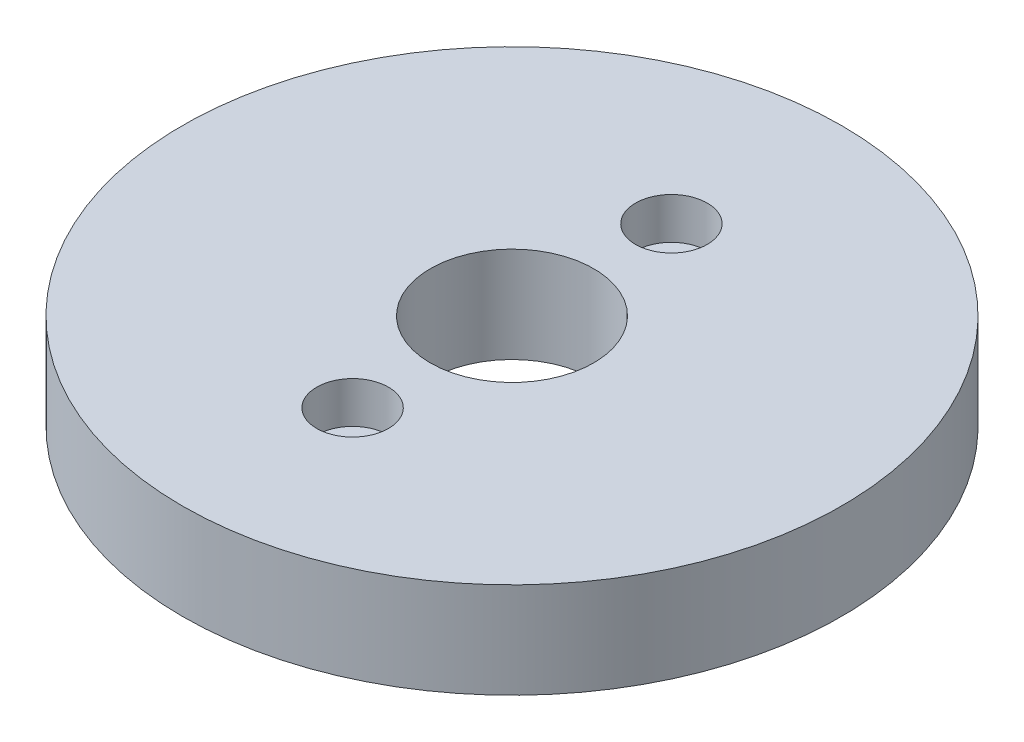
from build123d import *

# Parameters (mm, degrees)
SKETCH1_R           = 41.35
BOSS_EXTRUDE1_DEPTH = 12
SKETCH2_R           = 2.75
CUT_EXTRUDE1_DEPTH  = 25
SKETCH4_R           = 10.25
CUT_EXTRUDE2_DEPTH  = 25
SKETCH3_R           = 4.5
CUT_EXTRUDE3_DEPTH  = 5.2


with BuildPart() as part:
    # Sketch1 → Boss-Extrude1 (new body)
    with BuildSketch(Plane(origin=(0, 0, 0), x_dir=(1, 0, 0), z_dir=(0, 1, 0))):
        with Locations(Location((0, 0, 0), (0, 0, 270))):
            Circle(SKETCH1_R)
    extrude(amount=BOSS_EXTRUDE1_DEPTH)

    # Sketch2 → Cut-Extrude1 (cut)
    with BuildSketch(Plane(origin=(0, 12, 0), x_dir=(1, 0, 0), z_dir=(0, 1, 0))):
        with Locations(Location((0, 20, 0), (0, 0, 270))):
            Circle(SKETCH2_R)
        with Locations(Location((0, -20, 0), (0, 0, 270))):
            Circle(SKETCH2_R)
    extrude(amount=-CUT_EXTRUDE1_DEPTH, mode=Mode.SUBTRACT)

    # Sketch4 → Cut-Extrude2 (cut)
    with BuildSketch(Plane(origin=(0, 12, 0), x_dir=(1, 0, 0), z_dir=(0, 1, 0))):
        with Locations(Location((0, 0, 0), (0, 0, 270))):
            Circle(SKETCH4_R)
    extrude(amount=-CUT_EXTRUDE2_DEPTH, mode=Mode.SUBTRACT)

    # Sketch3 → Cut-Extrude3 (cut)
    with BuildSketch(Plane(origin=(0, 12, 0), x_dir=(1, 0, 0), z_dir=(0, 1, 0))):
        with Locations(Location((0, 20, 0), (0, 0, 270))):
            Circle(SKETCH3_R)
        with Locations(Location((0, -20, 0), (0, 0, 270))):
            Circle(SKETCH3_R)
    extrude(amount=-CUT_EXTRUDE3_DEPTH, mode=Mode.SUBTRACT)


solid = part.part
